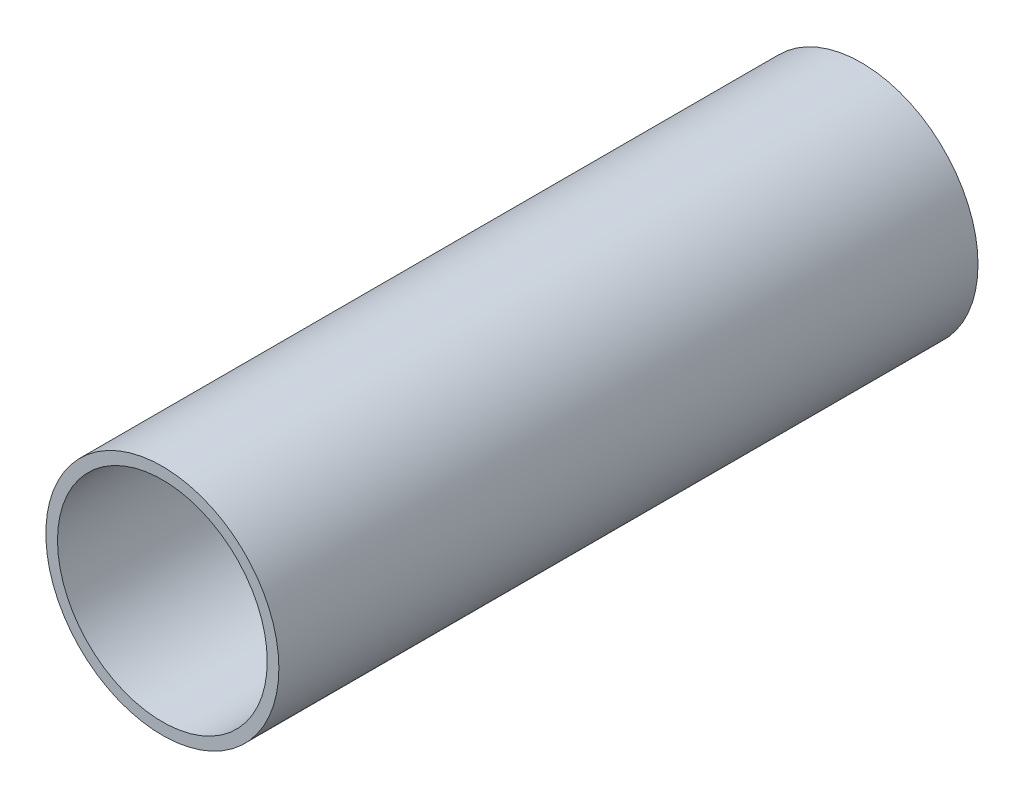
from build123d import *

# Parameters (mm, degrees)
SKETCH1_R           = 10
SKETCH1_R_2         = 9
BOSS_EXTRUDE1_DEPTH = 60


with BuildPart() as part:
    # Sketch1 → Boss-Extrude1 (new body)
    with BuildSketch(Plane.XY):
        Circle(SKETCH1_R)
        Circle(SKETCH1_R_2, mode=Mode.SUBTRACT)
    extrude(amount=BOSS_EXTRUDE1_DEPTH)


solid = part.part
